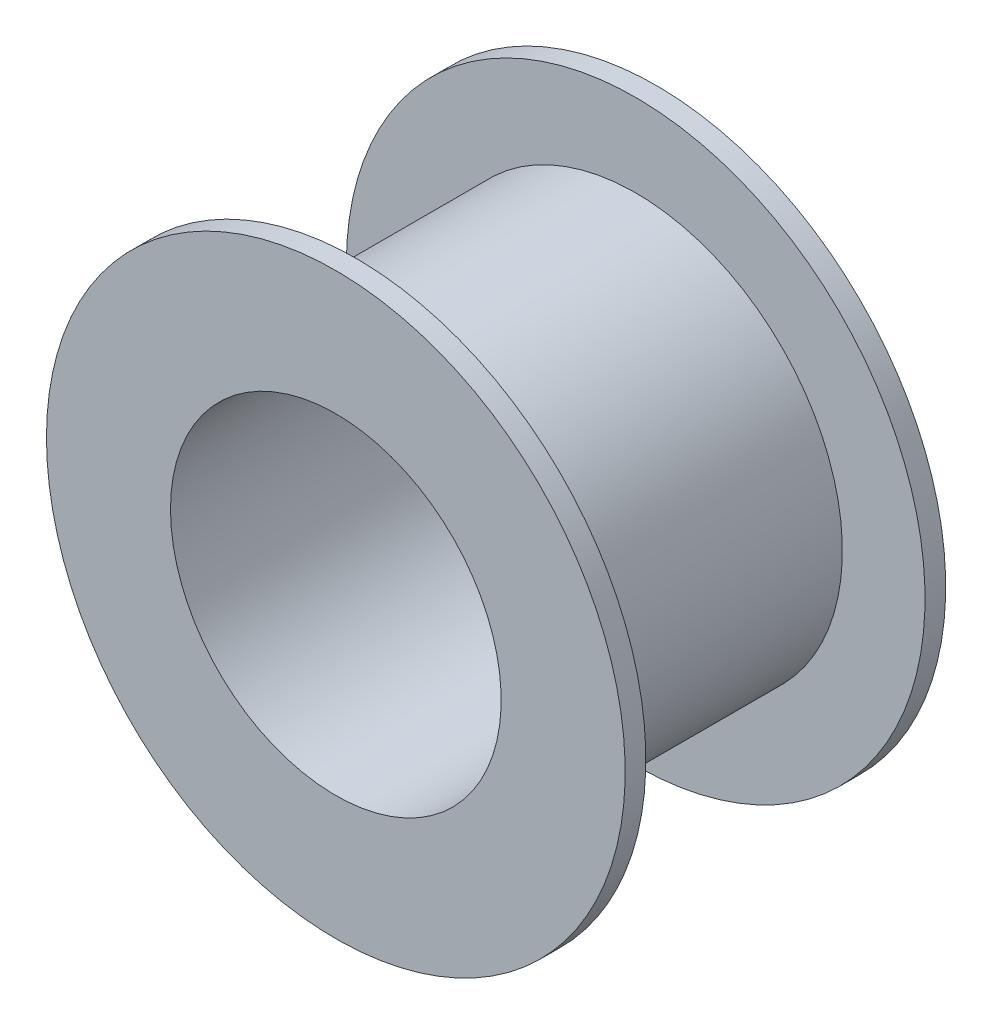
from build123d import *


with BuildPart() as part:
    # Sketch2 → Revolve1 (revolve)
    with BuildSketch(Plane.YZ, mode=Mode.PRIVATE) as revolve1_sk:
        Polygon((-50.8, 0), (-88.9, 0), (-88.9, 6.35), (-63.5, 6.35), (-63.5, 92.123846154), (-88.9, 92.123846154), (-88.9, 98.473846154), (-50.8, 98.473846154), align=None)
    revolve(revolve1_sk.sketch.rotate(Axis((0, 0, 0), (0, 0, 1)), 270), axis=Axis((0, 0, 0), (0, 0, 1)))


solid = part.part
